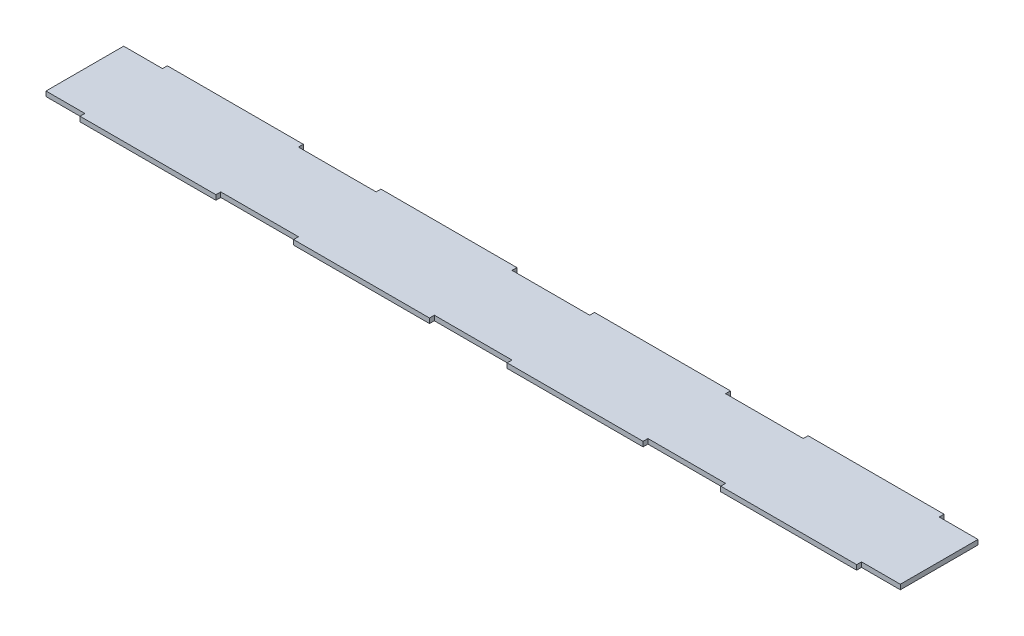
from build123d import *

# Parameters (mm, degrees)
BOSS_EXTRUDE1_DEPTH = 3.175


with BuildPart() as part:
    # Sketch1 → Boss-Extrude1 (new body)
    with BuildSketch(Plane(origin=(0, 0, 0), x_dir=(1, 0, 0), z_dir=(0, 1, 0))):
        Polygon((0, -25.4), (0, 25.4), (25.4, 25.4), (25.4, 28.575), (114.3, 28.575), (114.3, 25.4), (139.7, 25.4), (165.1, 25.4), (165.1, 28.575), (254, 28.575), (254, 25.4), (279.4, 25.4), (304.8, 25.4), (304.8, 28.575), (393.7, 28.575), (393.7, 25.4), (419.1, 25.4), (444.5, 25.4), (444.5, 28.575), (533.4, 28.575), (533.4, 25.4), (558.8, 25.4), (558.8, -25.4), (533.4, -25.4), (533.4, -28.575), (444.5, -28.575), (444.5, -25.4), (419.1, -25.4), (393.7, -25.4), (393.7, -28.575), (304.8, -28.575), (304.8, -25.4), (279.4, -25.4), (254, -25.4), (254, -28.575), (165.1, -28.575), (165.1, -25.4), (139.7, -25.4), (114.3, -25.4), (114.3, -28.575), (25.4, -28.575), (25.4, -25.4), align=None)
    extrude(amount=BOSS_EXTRUDE1_DEPTH)


solid = part.part
